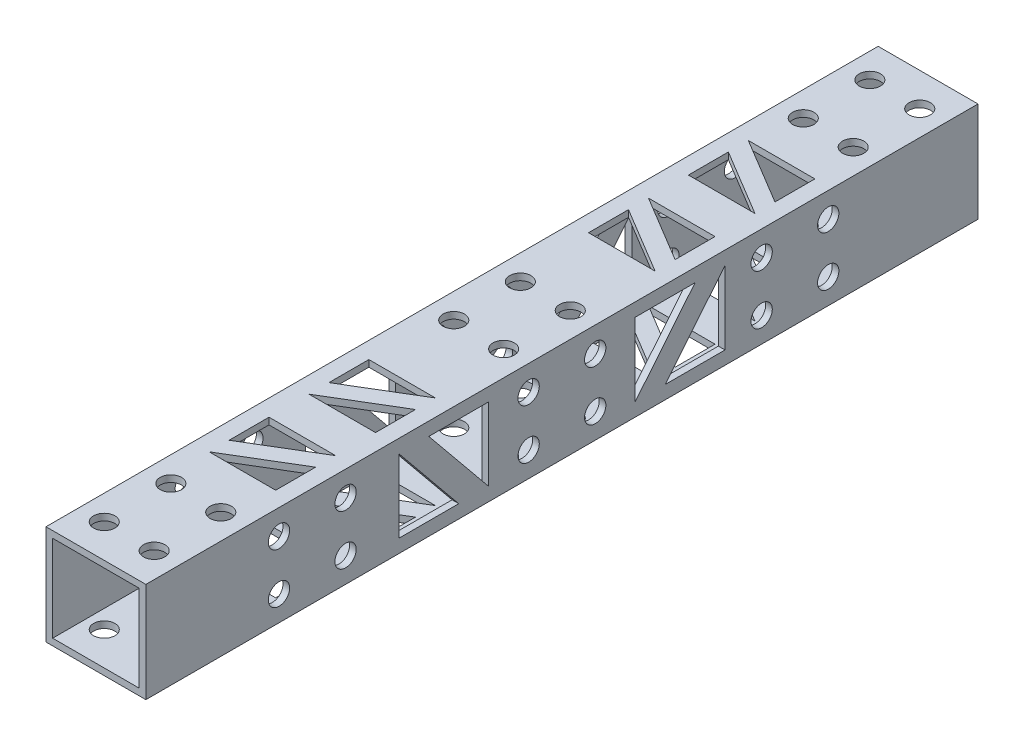
from build123d import *

# Parameters (mm, degrees)
SKETCH_1_W          = 15
SKETCH_1_H          = 15
SKETCH_1_W_2        = 13
SKETCH_1_H_2        = 13
EXTRUDE_1_DEPTH     = 125
SKETCH_2_R          = 1.6
CUT_EXTRUDE_1_DEPTH = 127.787223331
SKETCH_3_R          = 1.6
CUT_EXTRUDE_2_DEPTH = 127.787223331


with BuildPart() as part:
    # 草图1 → 拉伸-薄壁1 (new body)
    with BuildSketch(Plane.XY):
        with Locations((7.5, -7.5)):
            Rectangle(SKETCH_1_W, SKETCH_1_H)
        with Locations((7.5, -7.5)):
            Rectangle(SKETCH_1_W_2, SKETCH_1_H_2, mode=Mode.SUBTRACT)
    extrude(amount=EXTRUDE_1_DEPTH)

    # 草图2 → 切除-拉伸1 (cut, through all)
    with BuildSketch(Plane(origin=(15, 0, 0), x_dir=(0, 0, -1), z_dir=(1, 0, 0))):
        with Locations((-105, -3.75)):
            Circle(SKETCH_2_R)
        with Locations((-105, -11.25)):
            Circle(SKETCH_2_R)
        with Locations((-95, -11.25)):
            Circle(SKETCH_2_R)
        with Locations((-95, -3.75)):
            Circle(SKETCH_2_R)
        with Locations((-22.5, -3.75)):
            Circle(SKETCH_2_R)
        with Locations((-22.5, -11.25)):
            Circle(SKETCH_2_R)
        with Locations((-32.5, -11.25)):
            Circle(SKETCH_2_R)
        with Locations((-32.5, -3.75)):
            Circle(SKETCH_2_R)
        with Locations((-57.5, -11.25)):
            Circle(SKETCH_2_R)
        with Locations((-67.5, -11.25)):
            Circle(SKETCH_2_R)
        with Locations((-67.5, -3.75)):
            Circle(SKETCH_2_R)
        with Locations((-57.5, -3.75)):
            Circle(SKETCH_2_R)
        Polygon((-87, -2), (-87, -13), (-78, -13), align=None)
        Polygon((-82.5, -2), (-73.5, -2), (-73.5, -13), align=None)
        Polygon((-51.5, -13), (-42.5, -2), (-51.5, -2), align=None)
        Polygon((-47, -13), (-38, -2), (-38, -13), align=None)
    extrude(amount=-CUT_EXTRUDE_1_DEPTH, mode=Mode.SUBTRACT)

    # 草图3 → 切除-拉伸2 (cut, through all)
    with BuildSketch(Plane(origin=(0, 0, 0), x_dir=(1, 0, 0), z_dir=(0, 1, 0))):
        with Locations(Location((3.75, -5, 0), (0, 0, 270))):
            Circle(SKETCH_3_R)
        with Locations(Location((11.25, -5, 0), (0, 0, 90))):
            Circle(SKETCH_3_R)
        with Locations(Location((11.25, -15, 0), (0, 0, 270))):
            Circle(SKETCH_3_R)
        with Locations(Location((3.75, -15, 0), (0, 0, 90))):
            Circle(SKETCH_3_R)
        with Locations(Location((3.75, -57.5, 0), (0, 0, 270))):
            Circle(SKETCH_3_R)
        with Locations(Location((11.25, -57.5, 0), (0, 0, 90))):
            Circle(SKETCH_3_R)
        with Locations(Location((11.25, -67.5, 0), (0, 0, 270))):
            Circle(SKETCH_3_R)
        with Locations(Location((3.75, -67.5, 0), (0, 0, 90))):
            Circle(SKETCH_3_R)
        with Locations(Location((3.75, -110, 0), (0, 0, 270))):
            Circle(SKETCH_3_R)
        with Locations(Location((11.25, -110, 0), (0, 0, 90))):
            Circle(SKETCH_3_R)
        with Locations(Location((11.25, -120, 0), (0, 0, 270))):
            Circle(SKETCH_3_R)
        with Locations(Location((3.75, -120, 0), (0, 0, 90))):
            Circle(SKETCH_3_R)
        Polygon((2.5, -25), (2.5, -31), (12.5, -31), align=None)
        Polygon((2.5, -22), (12.5, -22), (12.5, -28), align=None)
        Polygon((2.5, -37), (12.5, -37), (12.5, -43), align=None)
        Polygon((12.5, -46), (2.5, -40), (2.5, -46), align=None)
        Polygon((2.5, -79), (12.5, -79), (2.5, -85), align=None)
        Polygon((12.5, -82), (2.5, -88), (12.5, -88), align=None)
        Polygon((12.5, -97), (2.5, -103), (12.5, -103), align=None)
        Polygon((12.5, -94), (2.5, -100), (2.5, -94), align=None)
    extrude(amount=-CUT_EXTRUDE_2_DEPTH, mode=Mode.SUBTRACT)


solid = part.part
